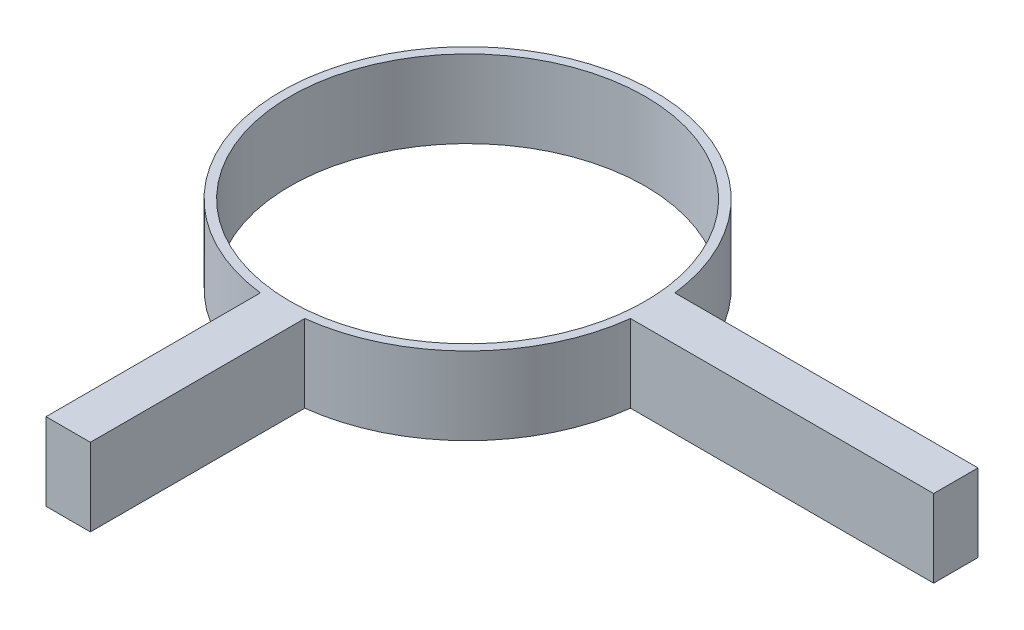
from build123d import *

# Parameters (mm, degrees)
SKETCH1_R           = 16
BOSS_EXTRUDE1_DEPTH = 7


with BuildPart() as part:
    # Sketch1 → Boss-Extrude1 (new body)
    with BuildSketch(Plane(origin=(0, 0, 0), x_dir=(1, 0, 0), z_dir=(0, 1, 0))):
        with BuildLine():
            Line((2, -36), (2, -16.68052757))
            ThreePointArc((2, -16.68052757), (11.879393924, -11.879393924), (16.68052757, -2))
            Line((16.68052757, -2), (44, -2))
            Line((44, -2), (44, 2))
            Line((44, 2), (16.68052757, 2))
            ThreePointArc((16.68052757, 2), (-11.879393924, 11.879393924), (-2, -16.68052757))
            Line((-2, -16.68052757), (-2, -36))
            Line((-2, -36), (2, -36))
        make_face()
        with Locations(Location((0, 0, 0), (0, 0, 270))):
            Circle(SKETCH1_R, mode=Mode.SUBTRACT)
    extrude(amount=BOSS_EXTRUDE1_DEPTH)


solid = part.part
